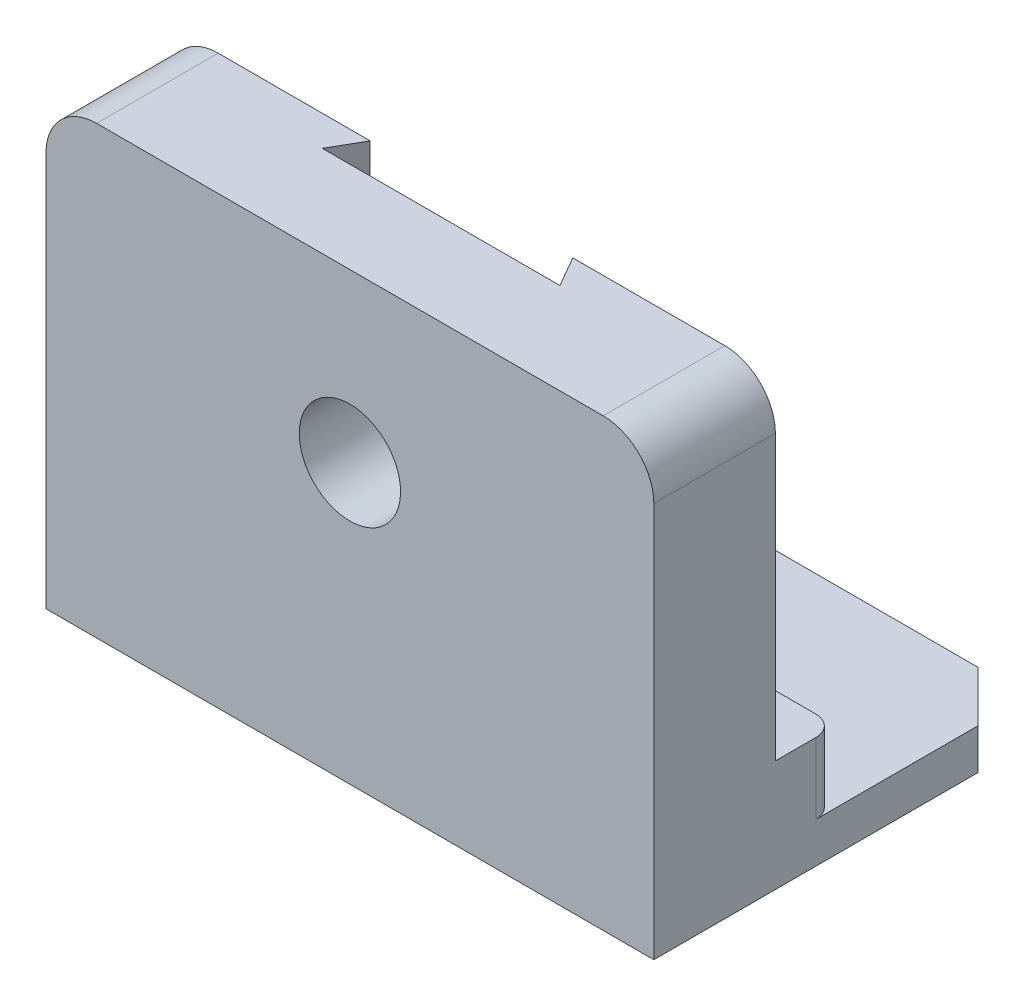
from build123d import *

# Parameters (mm, degrees)
ESTRUSIONE_ESTRUSIONE1_DEPTH = 30
SCHIZZO6_W                   = 26
SCHIZZO6_H                   = 19
TAGLIO_ESTRUSIONE2_DEPTH     = 7
TAGLIO_ESTRUSIONE3_DEPTH     = 3
TAGLIO_ESTRUSIONE3_DRAFT     = 30
FORO_10_0_10_1_D             = 10
FORO_4_0_4_1_D               = 4
RACCORDO1_R                  = 5
RACCORDO2_R                  = 6
RACCORDO3_R                  = 2
SMUSSO1_SIZE                 = 5


with BuildPart() as part:
    # Schizzo2 → Estrusione-Estrusione1 (new, symmetric)
    with BuildSketch(Plane(origin=(0, 0, 0), x_dir=(0, 0, -1), z_dir=(1, 0, 0))):
        Polygon((0, 44), (12, 44), (12, 11), (37, 11), (37, 0), (0, 0), align=None)
    extrude(amount=ESTRUSIONE_ESTRUSIONE1_DEPTH, both=True)

    # Schizzo6 → Taglio-Estrusione2 (cut)
    with BuildSketch(Plane(origin=(0, 11, 0), x_dir=(1, 0, 0), z_dir=(0, 1, 0))):
        with Locations((-17, 27.5)):
            Rectangle(SCHIZZO6_W, SCHIZZO6_H)
        with Locations((17, 27.5)):
            Rectangle(SCHIZZO6_W, SCHIZZO6_H)
    extrude(amount=-TAGLIO_ESTRUSIONE2_DEPTH, mode=Mode.SUBTRACT)


with BuildPart() as taglio_estrusione3_tool:
    # Schizzo7 → Taglio-Estrusione3 (with draft: the straight prism first)
    with BuildSketch(Plane(origin=(0, 0, -12), x_dir=(-1, 0, 0), z_dir=(0, 0, -1))):
        with BuildLine():
            Line((9.999988724, 44), (-10.000011276, 44))
            Line((-10.000011276, 44), (-10, 27.499993166))
            ThreePointArc((-10, 27.499993166), (6.834e-06, 17.5), (10, 27.500006834))
            Line((10, 27.500006834), (9.999988724, 44))
        make_face()
    extrude(amount=-TAGLIO_ESTRUSIONE3_DEPTH)
    # Taglio-Estrusione3: the draft: its side faces are tilted about the plane it starts from
    taglio_estrusione3_sides = [taglio_estrusione3_tool.faces().sort_by_distance(p)[0] for p in [
        (-9.999994362, 35.750003417, -10.5),
        (1.1276e-05, 44, -10.5),
        (10.000005638, 35.749996583, -10.5),
        (-6.834e-06, 17.5, -10.5),
    ]]
    draft(taglio_estrusione3_sides, Plane(origin=(0, 0, -12), x_dir=(-1, 0, 0), z_dir=(0, 0, -1)), TAGLIO_ESTRUSIONE3_DRAFT)


with BuildPart() as part_1:
    add(part.part)

    # Taglio-Estrusione3: cut by taglio_estrusione3_tool
    add(taglio_estrusione3_tool.part, mode=Mode.SUBTRACT)

    # Foro Ø10.0 (10)-1 (through all)
    with Locations(Plane(origin=(0, 0, -9), x_dir=(-1, 0, 0), z_dir=(0, 0, -1))):
        with Locations((-7.048e-06, 27.5)):
            Hole(FORO_10_0_10_1_D / 2)

    # Foro Ø4.0 (4)-1 (through all)
    with Locations(Plane(origin=(0, 11, 0), x_dir=(1, 0, 0), z_dir=(0, 1, 0))):
        with Locations((0, 31), (-24, 15), (24, 15)):
            Hole(FORO_4_0_4_1_D / 2)

    # Raccordo1
    raccordo1_edges = [part_1.edges().sort_by_distance(p)[0] for p in [
        (30, 44, -6),
        (-30, 44, -6),
    ]]
    fillet(raccordo1_edges, radius=RACCORDO1_R)

    # Raccordo2
    raccordo2_edges = [part_1.edges().sort_by_distance(p)[0] for p in [
        (-4, 7.5, -18),
        (4, 7.5, -18),
    ]]
    fillet(raccordo2_edges, radius=RACCORDO2_R)

    # Raccordo3
    raccordo3_edges = [part_1.edges().sort_by_distance(p)[0] for p in [
        (-30, 7.5, -18),
        (-4, 7.5, -37),
        (4, 7.5, -37),
        (30, 7.5, -18),
    ]]
    fillet(raccordo3_edges, radius=RACCORDO3_R)

    # Smusso1
    smusso1_edges = [part_1.edges().sort_by_distance(p)[0] for p in [
        (30, 2, -37),
        (-30, 2, -37),
    ]]
    chamfer(smusso1_edges, length=SMUSSO1_SIZE)


solid = part_1.part
